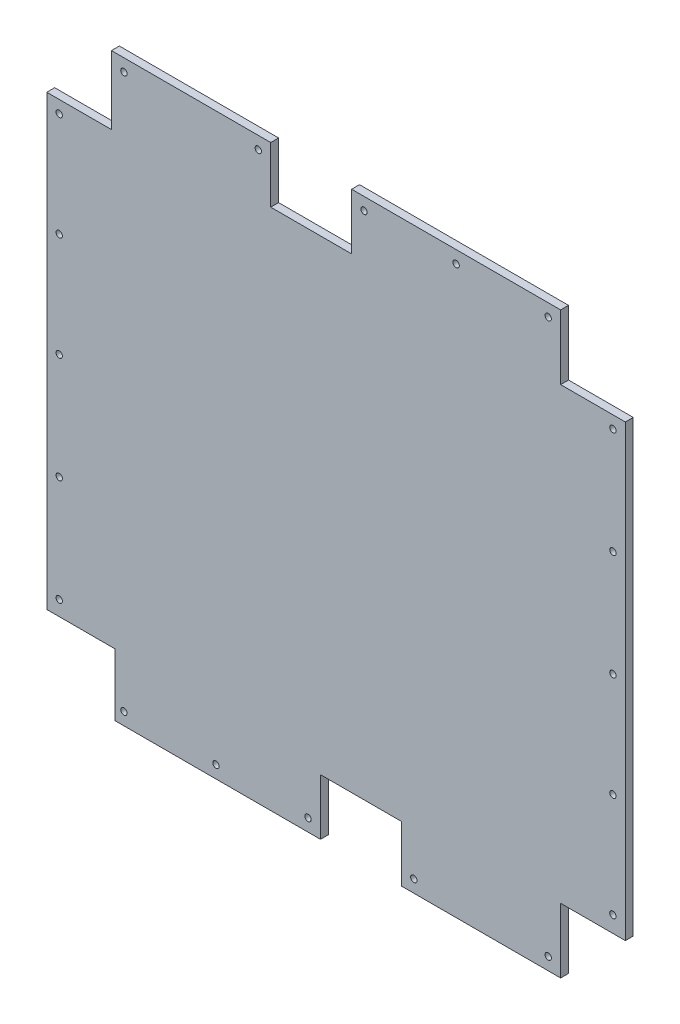
from build123d import *

# Parameters (mm, degrees)
SKETCH1_R           = 2.55
BOSS_EXTRUDE1_DEPTH = 6.35


with BuildPart() as part:
    # Sketch1 → Boss-Extrude1 (new body)
    with BuildSketch(Plane.XY):
        Polygon((12.5, 232.5), (180.5, 232.5), (180.5, 180.5), (232.5, 180.5), (232.5, -180.5), (180.5, -180.5), (180.5, -232.5), (52.5, -232.5), (52.5, -187.5), (-12.5, -187.5), (-12.5, -232.5), (-177.5, -232.5), (-177.5, -182.5), (-232.5, -182.5), (-232.5, 177.5), (-180.5, 177.5), (-180.5, 232.5), (-52.5, 232.5), (-52.5, 187.5), (12.5, 187.5), align=None)
        with Locations((222.5, 170.5)):
            Circle(SKETCH1_R, mode=Mode.SUBTRACT)
        with Locations((170.5, 222.5)):
            Circle(SKETCH1_R, mode=Mode.SUBTRACT)
        with Locations((22.5, 222.5)):
            Circle(SKETCH1_R, mode=Mode.SUBTRACT)
        with Locations((96.5, 222.5)):
            Circle(SKETCH1_R, mode=Mode.SUBTRACT)
        with Locations((-170.5, 222.5)):
            Circle(SKETCH1_R, mode=Mode.SUBTRACT)
        with Locations((-62.5, 222.5)):
            Circle(SKETCH1_R, mode=Mode.SUBTRACT)
        with Locations((-222.5, 167.5)):
            Circle(SKETCH1_R, mode=Mode.SUBTRACT)
        with Locations((222.5, 0)):
            Circle(SKETCH1_R, mode=Mode.SUBTRACT)
        with Locations((222.5, 85.25)):
            Circle(SKETCH1_R, mode=Mode.SUBTRACT)
        with Locations((-222.5, 0)):
            Circle(SKETCH1_R, mode=Mode.SUBTRACT)
        with Locations((-222.5, 83.75)):
            Circle(SKETCH1_R, mode=Mode.SUBTRACT)
        with Locations((222.5, -83.75)):
            Circle(SKETCH1_R, mode=Mode.SUBTRACT)
        with Locations((222.5, -167.5)):
            Circle(SKETCH1_R, mode=Mode.SUBTRACT)
        with Locations((170.5, -222.5)):
            Circle(SKETCH1_R, mode=Mode.SUBTRACT)
        with Locations((62.5, -222.5)):
            Circle(SKETCH1_R, mode=Mode.SUBTRACT)
        with Locations((-22.5, -222.5)):
            Circle(SKETCH1_R, mode=Mode.SUBTRACT)
        with Locations((-96.5, -222.5)):
            Circle(SKETCH1_R, mode=Mode.SUBTRACT)
        with Locations((-170.5, -222.5)):
            Circle(SKETCH1_R, mode=Mode.SUBTRACT)
        with Locations((-222.5, -170.5)):
            Circle(SKETCH1_R, mode=Mode.SUBTRACT)
        with Locations((-222.5, -85.25)):
            Circle(SKETCH1_R, mode=Mode.SUBTRACT)
    extrude(amount=BOSS_EXTRUDE1_DEPTH)


solid = part.part
